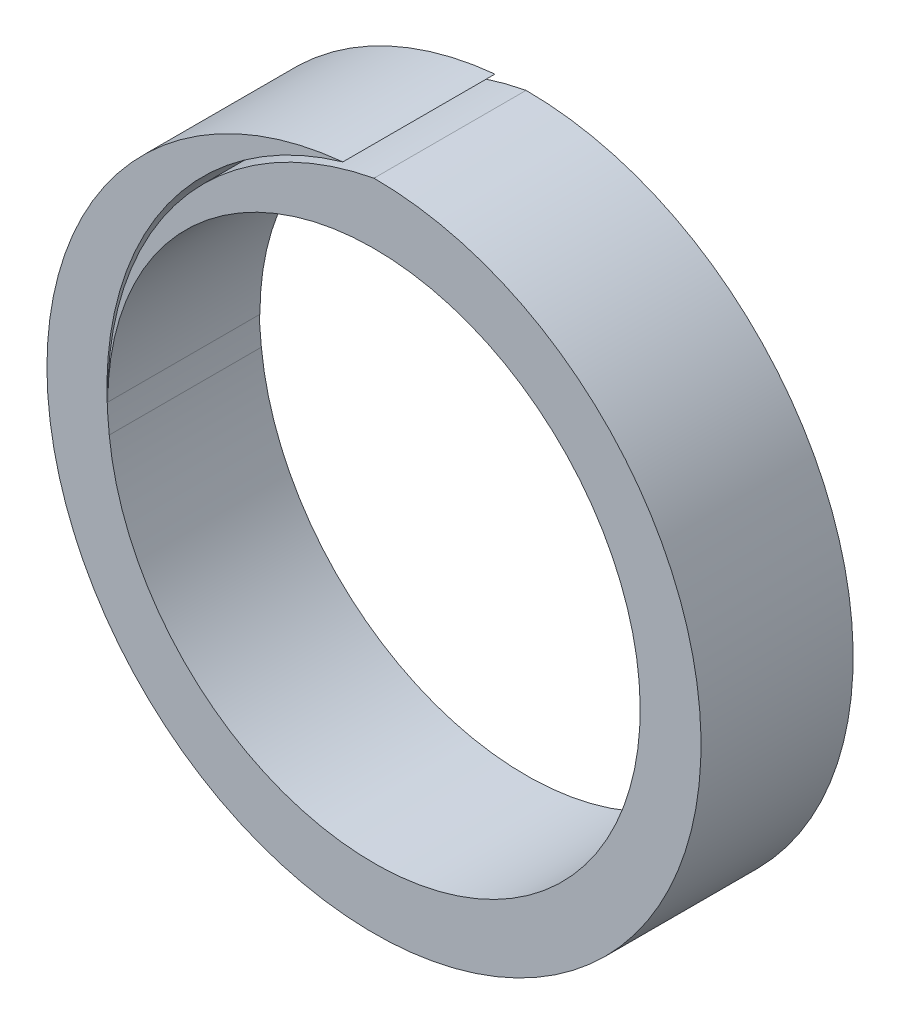
from build123d import *

# Parameters (mm, degrees)
BOSS_EXTRUDE1_DEPTH = 5


with BuildPart() as part:
    # Sketch1 → Boss-Extrude1 (new body)
    with BuildSketch(Plane.XY):
        with BuildLine():
            ThreePointArc((-8.702283154, -0.912561185), (8.738062645, 0.456903932), (-8.75, 0))
            ThreePointArc((-8.75, 0), (-6.338924673, 6.973543338), (0, 10.75))
            ThreePointArc((0, 10.75), (0.512602522, -10.737771587), (-1.024038846, 10.701114168))
            ThreePointArc((-1.024038846, 10.701114168), (-6.997208163, 6.305176572), (-8.702283154, -0.912561185))
        make_face()
    extrude(amount=BOSS_EXTRUDE1_DEPTH)


solid = part.part
